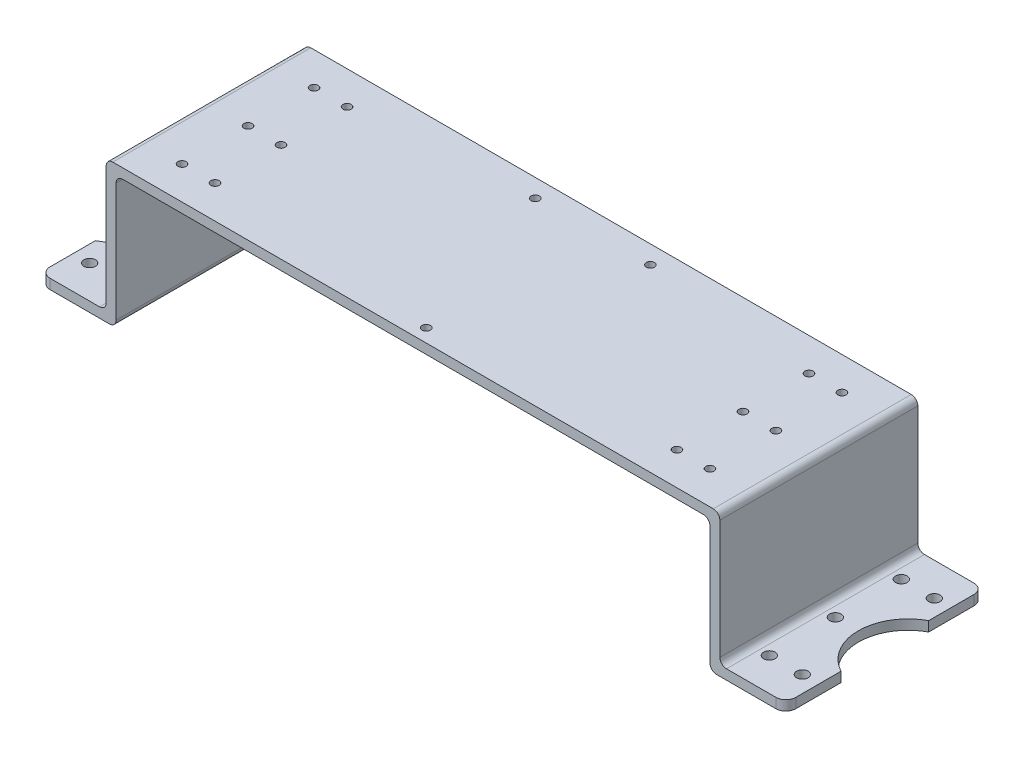
from build123d import *

# Parameters (mm, degrees)
SKETCH_1_W                  = 186
SKETCH_1_H                  = 60
EXTRUDE_1_DEPTH             = 3
SKETCH_2_W                  = 3
SKETCH_2_H                  = 60
EXTRUDE_2_DEPTH             = 40
SKETCH_3_W                  = 60
SKETCH_3_H                  = 3
EXTRUDE_3_DEPTH             = 20
SKETCH_4_R                  = 1.75
CUT_EXTRUDE_1_DEPTH         = 124.567795157
PATTERN_LINEAR_1_COUNT      = 3
PATTERN_LINEAR_1_PITCH      = 20
PATTERN_LINEAR_1_COUNT_DIR2 = 2
PATTERN_LINEAR_1_PITCH_DIR2 = 10
MIRROR_4_COPY_1_SKETCH_R    = 1.75
MIRROR_4_COPY_1_DEPTH       = 124.567795157
MIRROR_4_COPY_2_SKETCH_R    = 1.75
MIRROR_4_COPY_2_DEPTH       = 124.567795157
MIRROR_4_COPY_3_SKETCH_R    = 1.75
MIRROR_4_COPY_3_DEPTH       = 124.567795157
MIRROR_4_COPY_4_SKETCH_R    = 1.75
MIRROR_4_COPY_4_DEPTH       = 124.567795157
MIRROR_4_COPY_5_SKETCH_R    = 1.75
MIRROR_4_COPY_5_DEPTH       = 124.567795157
SKETCH_5_R                  = 1
CUT_EXTRUDE_2_DEPTH         = 3
SKETCH_6_R                  = 1
CUT_EXTRUDE_3_DEPTH         = 3
SKETCH_7_R                  = 1
CUT_EXTRUDE_4_DEPTH         = 3
PATTERN_LINEAR_2_COUNT      = 3
PATTERN_LINEAR_2_PITCH      = 20
PATTERN_LINEAR_2_COUNT_DIR2 = 2
PATTERN_LINEAR_2_PITCH_DIR2 = 10
MIRROR_6_COPY_1_SKETCH_R    = 1
MIRROR_6_COPY_1_DEPTH       = 3
MIRROR_6_COPY_2_SKETCH_R    = 1
MIRROR_6_COPY_2_DEPTH       = 3
MIRROR_6_COPY_3_SKETCH_R    = 1
MIRROR_6_COPY_3_DEPTH       = 3
MIRROR_6_COPY_4_SKETCH_R    = 1
MIRROR_6_COPY_4_DEPTH       = 3
MIRROR_6_COPY_5_SKETCH_R    = 1
MIRROR_6_COPY_5_DEPTH       = 3
HOLE_WIZARD_M3_1_D          = 2.5
HOLE_WIZARD_M3_2_D          = 2.5
SKETCH_12_R                 = 15
CUT_EXTRUDE_5_DEPTH         = 124.567795157
FILLET_2_R                  = 2
FILLET_3_R                  = 2
FILLET_4_R                  = 2
FILLET_5_R                  = 3


with BuildPart() as part:
    # 草图1 → 凸台-拉伸1 (new body)
    with BuildSketch(Plane(origin=(0, 0, 0), x_dir=(1, 0, 0), z_dir=(0, 1, 0))):
        Rectangle(SKETCH_1_W, SKETCH_1_H)
    extrude(amount=EXTRUDE_1_DEPTH)

    # 草图2 → 凸台-拉伸2 (add)
    with BuildSketch(Plane.XZ):
        with Locations((-91.5, 0)):
            Rectangle(SKETCH_2_W, SKETCH_2_H)
    extrude_2 = extrude(amount=EXTRUDE_2_DEPTH)

    # 草图3 → 凸台-拉伸3 (add)
    with BuildSketch(Plane.ZY.offset(93)):
        with Locations((0, -38.5)):
            Rectangle(SKETCH_3_W, SKETCH_3_H)
    extrude_3 = extrude(amount=EXTRUDE_3_DEPTH)

    # 草图4 → 切除-拉伸1 (cut, through all)
    with BuildSketch(Plane(origin=(0, -37, 0), x_dir=(1, 0, 0), z_dir=(0, 1, 0))):
        with Locations(Location((-98, -20, 0), (0, 0, 270))):
            Circle(SKETCH_4_R)
    cut_extrude_1 = extrude(amount=-CUT_EXTRUDE_1_DEPTH, mode=Mode.SUBTRACT)

    # 阵列(线性)1: Cut-Extrude 1 3 × 2
    with Locations(*[(-j * PATTERN_LINEAR_1_PITCH_DIR2, 0, -i * PATTERN_LINEAR_1_PITCH) for i in range(PATTERN_LINEAR_1_COUNT) for j in range(PATTERN_LINEAR_1_COUNT_DIR2) if (i, j) != (0, 0)]):
        add(cut_extrude_1, mode=Mode.SUBTRACT)

    # 镜向4: 凸台-拉伸2, 凸台-拉伸3, 切除-拉伸1 across plane
    add(extrude_2.mirror(Plane(origin=(0, 0, 0), x_dir=(0, 0, 1), z_dir=(1, 0, 0))))
    add(extrude_3.mirror(Plane(origin=(0, 0, 0), x_dir=(0, 0, 1), z_dir=(1, 0, 0))))
    add(cut_extrude_1.mirror(Plane(origin=(0, 0, 0), x_dir=(0, 0, 1), z_dir=(1, 0, 0))), mode=Mode.SUBTRACT)

    # 镜向4 copy 1 sketch → 镜向4 copy 1 (cut, through all)
    with BuildSketch(Plane(origin=(10, -37, 0), x_dir=(-1, 0, 0), z_dir=(0, 1, 0))):
        with Locations((-98, 20)):
            Circle(MIRROR_4_COPY_1_SKETCH_R)
    extrude(amount=-MIRROR_4_COPY_1_DEPTH, mode=Mode.SUBTRACT)

    # 镜向4 copy 2 sketch → 镜向4 copy 2 (cut, through all)
    with BuildSketch(Plane(origin=(0, -37, -20), x_dir=(-1, 0, 0), z_dir=(0, 1, 0))):
        with Locations((-98, 20)):
            Circle(MIRROR_4_COPY_2_SKETCH_R)
    extrude(amount=-MIRROR_4_COPY_2_DEPTH, mode=Mode.SUBTRACT)

    # 镜向4 copy 3 sketch → 镜向4 copy 3 (cut, through all)
    with BuildSketch(Plane(origin=(10, -37, -20), x_dir=(-1, 0, 0), z_dir=(0, 1, 0))):
        with Locations((-98, 20)):
            Circle(MIRROR_4_COPY_3_SKETCH_R)
    extrude(amount=-MIRROR_4_COPY_3_DEPTH, mode=Mode.SUBTRACT)

    # 镜向4 copy 4 sketch → 镜向4 copy 4 (cut, through all)
    with BuildSketch(Plane(origin=(0, -37, -40), x_dir=(-1, 0, 0), z_dir=(0, 1, 0))):
        with Locations((-98, 20)):
            Circle(MIRROR_4_COPY_4_SKETCH_R)
    extrude(amount=-MIRROR_4_COPY_4_DEPTH, mode=Mode.SUBTRACT)

    # 镜向4 copy 5 sketch → 镜向4 copy 5 (cut, through all)
    with BuildSketch(Plane(origin=(10, -37, -40), x_dir=(-1, 0, 0), z_dir=(0, 1, 0))):
        with Locations((-98, 20)):
            Circle(MIRROR_4_COPY_5_SKETCH_R)
    extrude(amount=-MIRROR_4_COPY_5_DEPTH, mode=Mode.SUBTRACT)

    # 草图5 → 切除-拉伸2 (cut)
    with BuildSketch(Plane(origin=(0, 3, 0), x_dir=(1, 0, 0), z_dir=(0, 1, 0))):
        with Locations(Location((0, -26, 0), (0, 0, 270))):
            Circle(SKETCH_5_R)
    extrude(amount=-CUT_EXTRUDE_2_DEPTH, mode=Mode.SUBTRACT)

    # 草图6 → 切除-拉伸3 (cut)
    with BuildSketch(Plane(origin=(0, 3, 0), x_dir=(1, 0, 0), z_dir=(0, 1, 0))):
        with Locations(Location((-17.45, 24.5, 0), (0, 0, 270))):
            Circle(SKETCH_6_R)
    cut_extrude_3 = extrude(amount=-CUT_EXTRUDE_3_DEPTH, mode=Mode.SUBTRACT)

    # 镜向5: 切除-拉伸3 across plane
    add(cut_extrude_3.mirror(Plane(origin=(0, 0, 0), x_dir=(0, 0, 1), z_dir=(1, 0, 0))), mode=Mode.SUBTRACT)

    # 草图7 → 切除-拉伸4 (cut)
    with BuildSketch(Plane(origin=(0, 3, 0), x_dir=(1, 0, 0), z_dir=(0, 1, 0))):
        with Locations(Location((-70, -20, 0), (0, 0, 270))):
            Circle(SKETCH_7_R)
    cut_extrude_4 = extrude(amount=-CUT_EXTRUDE_4_DEPTH, mode=Mode.SUBTRACT)

    # 阵列(线性)2: Cut-Extrude 4 3 × 2
    with Locations(*[(-j * PATTERN_LINEAR_2_PITCH_DIR2, 0, -i * PATTERN_LINEAR_2_PITCH) for i in range(PATTERN_LINEAR_2_COUNT) for j in range(PATTERN_LINEAR_2_COUNT_DIR2) if (i, j) != (0, 0)]):
        add(cut_extrude_4, mode=Mode.SUBTRACT)

    # 镜向6: 切除-拉伸4 across plane
    add(cut_extrude_4.mirror(Plane(origin=(0, 0, 0), x_dir=(0, 0, 1), z_dir=(1, 0, 0))), mode=Mode.SUBTRACT)

    # 镜向6 copy 1 sketch → 镜向6 copy 1 (cut)
    with BuildSketch(Plane(origin=(10, 3, 0), x_dir=(-1, 0, 0), z_dir=(0, 1, 0))):
        with Locations((-70, 20)):
            Circle(MIRROR_6_COPY_1_SKETCH_R)
    extrude(amount=-MIRROR_6_COPY_1_DEPTH, mode=Mode.SUBTRACT)

    # 镜向6 copy 2 sketch → 镜向6 copy 2 (cut)
    with BuildSketch(Plane(origin=(0, 3, -20), x_dir=(-1, 0, 0), z_dir=(0, 1, 0))):
        with Locations((-70, 20)):
            Circle(MIRROR_6_COPY_2_SKETCH_R)
    extrude(amount=-MIRROR_6_COPY_2_DEPTH, mode=Mode.SUBTRACT)

    # 镜向6 copy 3 sketch → 镜向6 copy 3 (cut)
    with BuildSketch(Plane(origin=(10, 3, -20), x_dir=(-1, 0, 0), z_dir=(0, 1, 0))):
        with Locations((-70, 20)):
            Circle(MIRROR_6_COPY_3_SKETCH_R)
    extrude(amount=-MIRROR_6_COPY_3_DEPTH, mode=Mode.SUBTRACT)

    # 镜向6 copy 4 sketch → 镜向6 copy 4 (cut)
    with BuildSketch(Plane(origin=(0, 3, -40), x_dir=(-1, 0, 0), z_dir=(0, 1, 0))):
        with Locations((-70, 20)):
            Circle(MIRROR_6_COPY_4_SKETCH_R)
    extrude(amount=-MIRROR_6_COPY_4_DEPTH, mode=Mode.SUBTRACT)

    # 镜向6 copy 5 sketch → 镜向6 copy 5 (cut)
    with BuildSketch(Plane(origin=(10, 3, -40), x_dir=(-1, 0, 0), z_dir=(0, 1, 0))):
        with Locations((-70, 20)):
            Circle(MIRROR_6_COPY_5_SKETCH_R)
    extrude(amount=-MIRROR_6_COPY_5_DEPTH, mode=Mode.SUBTRACT)

    # M3 螺纹孔1 (through all)
    with Locations(Plane(origin=(0, 3, 0), x_dir=(1, 0, 0), z_dir=(0, 1, 0))):
        with Locations((-80, -20), (-70, -20), (-70, 0), (-80, 0), (-70, 20), (-80, 20), (70, -20), (80, -20), (70, 0), (80, 0), (70, 20), (80, 20)):
            Hole(HOLE_WIZARD_M3_1_D / 2)

    # M3 螺纹孔2 (through all)
    with Locations(Plane(origin=(0, 3, 0), x_dir=(1, 0, 0), z_dir=(0, 1, 0))):
        with Locations((-17.45, 24.5), (17.45, 24.5), (0, -26)):
            Hole(HOLE_WIZARD_M3_2_D / 2)

    # 草图12 → 切除-拉伸5 (cut, through all)
    with BuildSketch(Plane(origin=(0, -37, 0), x_dir=(1, 0, 0), z_dir=(0, 1, 0))):
        with Locations((-120, 0)):
            Circle(SKETCH_12_R)
    cut_extrude_5 = extrude(amount=-CUT_EXTRUDE_5_DEPTH, mode=Mode.SUBTRACT)

    # 镜向7: 切除-拉伸5 across plane
    add(cut_extrude_5.mirror(Plane(origin=(0, 0, 0), x_dir=(0, 0, 1), z_dir=(1, 0, 0))), mode=Mode.SUBTRACT)

    # 圆角2
    fillet_2_edges = [part.edges().sort_by_distance(p)[0] for p in [
        (-90, 0, 0),
        (-93, 3, 0),
    ]]
    fillet(fillet_2_edges, radius=FILLET_2_R)

    # 圆角3
    fillet_3_edges = [part.edges().sort_by_distance(p)[0] for p in [
        (93, 3, 0),
        (90, 0, 0),
    ]]
    fillet(fillet_3_edges, radius=FILLET_3_R)

    # 圆角4
    fillet_4_edges = [part.edges().sort_by_distance(p)[0] for p in [
        (-90, -40, 0),
        (-93, -37, 0),
        (90, -40, 0),
        (93, -37, 0),
    ]]
    fillet(fillet_4_edges, radius=FILLET_4_R)

    # 圆角5
    fillet_5_edges = [part.edges().sort_by_distance(p)[0] for p in [
        (-113, -38.5, -30),
        (-113, -38.5, 30),
        (113, -38.5, 30),
        (113, -38.5, -30),
    ]]
    fillet(fillet_5_edges, radius=FILLET_5_R)


solid = part.part
